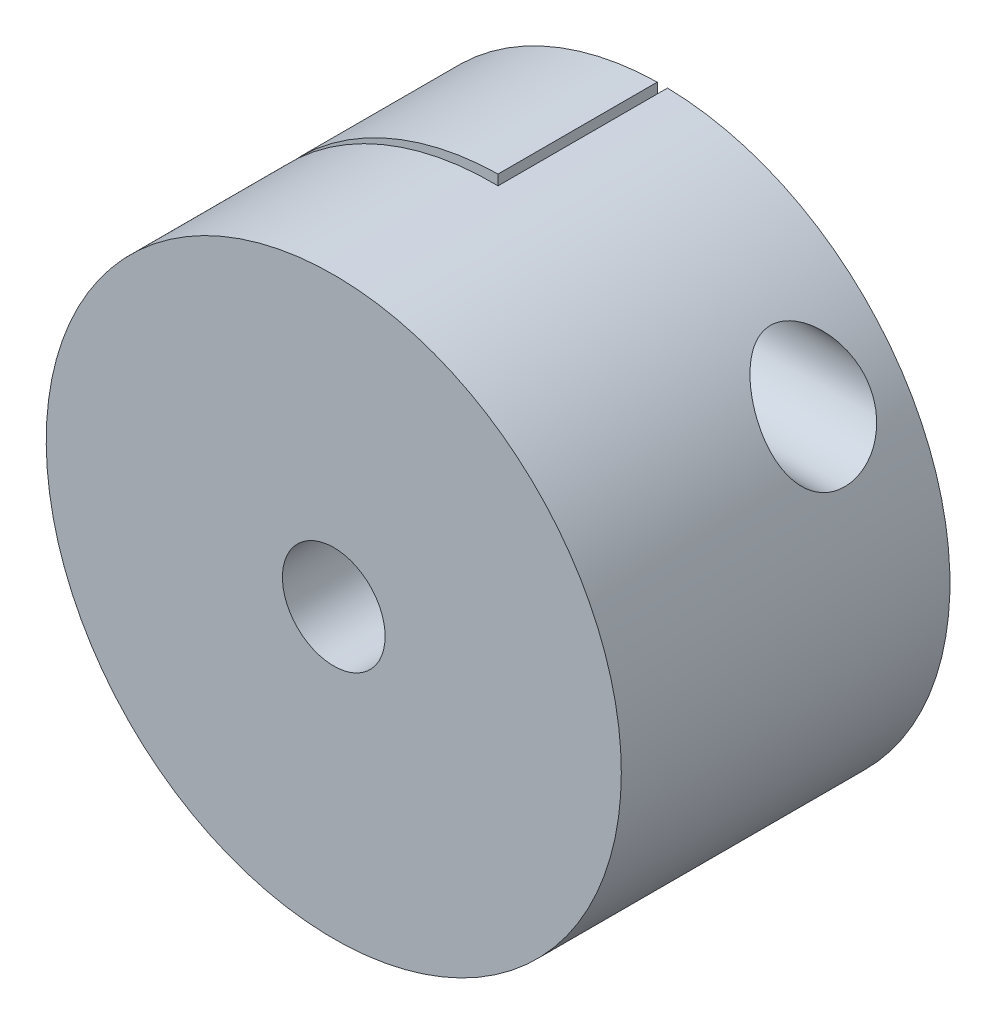
from build123d import *

# Parameters (mm, degrees)
SKETCH_1_R               = 14
SKETCH_1_R_2             = 2.5
EXTRUDE_1_DEPTH          = 16
CUT_EXTRUDE_1_DEPTH      = 26.455844123
CUT_EXTRUDE_1_DEPTH_BACK = 26.455844123
CUT_EXTRUDE_2_DEPTH      = 26.455844123
CUT_EXTRUDE_2_DEPTH_BACK = 26.455844123
SKETCH_3_R               = 1.5
CUT_EXTRUDE_START        = 3
SKETCH_3_4_R             = 2.5
SKETCH_3_4_R_2           = 1.5
CUT_EXTRUDE_3_DEPTH      = 23.455844296


with BuildPart() as part:
    # 草图1 → 凸台-拉伸1 (new body)
    with BuildSketch(Plane.XY):
        Circle(SKETCH_1_R)
        Circle(SKETCH_1_R_2, mode=Mode.SUBTRACT)
    extrude(amount=EXTRUDE_1_DEPTH)

    # 草图2 → 切除-拉伸1 (cut, two sides: drawn at the far end of the back side and taken through both)
    with BuildSketch(Plane(origin=(0, 0, 0), x_dir=(1, 0, 0), z_dir=(0, 1, 0)).offset(-CUT_EXTRUDE_1_DEPTH_BACK)):
        Polygon((-14, -7.75), (-14, -8.25), (0.25, -8.25), (0.25, 0), (-0.25, 0), (-0.25, -7.75), align=None)
    extrude(amount=CUT_EXTRUDE_1_DEPTH + CUT_EXTRUDE_1_DEPTH_BACK, mode=Mode.SUBTRACT)


with BuildPart() as cut_extrude_1_piece_1:
    # of the separate pieces the step leaves, piece 1, a body of its own (cut_extrude_1_pieces)
    add(part.part.solids().sort_by_distance((14, 0, 0))[0])


with BuildPart() as cut_extrude_1_piece_2:
    # of the separate pieces the step leaves, piece 2, a body of its own (cut_extrude_1_pieces)
    add(part.part.solids().sort_by_distance((-0.25, 13.997767679, 0))[0])


with BuildPart() as cut_extrude_2_tool:
    # 草图3 → 切除-拉伸2 (new, two sides: drawn at the far end of the back side and taken through both)
    with BuildSketch(Plane(origin=(0, 0, 0), x_dir=(0, 0, -1), z_dir=(1, 0, 0)).offset(-CUT_EXTRUDE_2_DEPTH_BACK)):
        with Locations((-4, 7.997767679)):
            Circle(SKETCH_3_R)
    extrude(amount=CUT_EXTRUDE_2_DEPTH + CUT_EXTRUDE_2_DEPTH_BACK)


with BuildPart() as cut_extrude_1_piece_1_1:
    add(cut_extrude_1_piece_1.part)

    # 切除-拉伸2: cut by cut_extrude_2_tool
    add(cut_extrude_2_tool.part, mode=Mode.SUBTRACT)

    # 草图3<4> → 切除-拉伸3 (cut, through all)
    with BuildSketch(Plane(origin=(0, 0, 0), x_dir=(0, 0, -1), z_dir=(1, 0, 0)).offset(CUT_EXTRUDE_START)):
        with Locations((-4, 7.997767679)):
            Circle(SKETCH_3_4_R)
        with Locations((-4, 7.997767679)):
            Circle(SKETCH_3_4_R_2, mode=Mode.SUBTRACT)
    extrude(amount=CUT_EXTRUDE_3_DEPTH, mode=Mode.SUBTRACT)


with BuildPart() as cut_extrude_1_piece_2_1:
    add(cut_extrude_1_piece_2.part)

    # 切除-拉伸2: cut by cut_extrude_2_tool
    add(cut_extrude_2_tool.part, mode=Mode.SUBTRACT)


solid = Compound([cut_extrude_1_piece_1_1.part, cut_extrude_1_piece_2_1.part])
